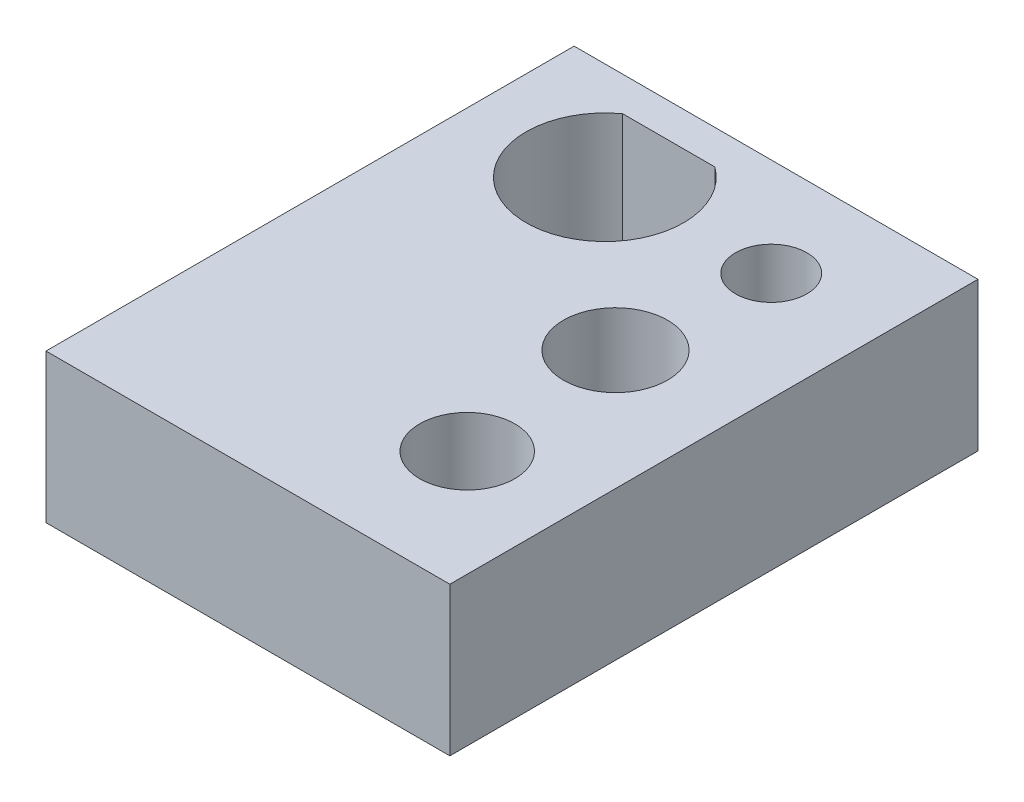
from build123d import *

# Parameters (mm, degrees)
SKETCH1_W           = 13.581948161
SKETCH1_H           = 17.761009134
SKETCH1_R           = 1.6
SKETCH1_R_2         = 1.2
SKETCH1_R_3         = 1.75
BOSS_EXTRUDE1_DEPTH = 5


with BuildPart() as part:
    # Sketch1 → Boss-Extrude1 (new body)
    with BuildSketch(Plane(origin=(0, 0, 0), x_dir=(1, 0, 0), z_dir=(0, 1, 0))):
        with Locations((-5.80679888, -4.339957405)):
            Rectangle(SKETCH1_W, SKETCH1_H)
        with Locations(Location((-2.596056365, -9.056132184, 0), (0, 0, 270))):
            Circle(SKETCH1_R, mode=Mode.SUBTRACT)
        with Locations(Location((-2.667047062, 1.237786047, 0), (0, 0, 270))):
            Circle(SKETCH1_R_2, mode=Mode.SUBTRACT)
        with Locations(Location((-3.046693025, -3.619626487, 0), (0, 0, 270))):
            Circle(SKETCH1_R_3, mode=Mode.SUBTRACT)
        with BuildLine():
            Line((-9.810909871, 3.387786047), (-6.712523194, 3.387786047))
            ThreePointArc((-6.712523194, 3.387786047), (-8.261716533, -1.412213953), (-9.810909871, 3.387786047))
        make_face(mode=Mode.SUBTRACT)
    extrude(amount=BOSS_EXTRUDE1_DEPTH)


solid = part.part
